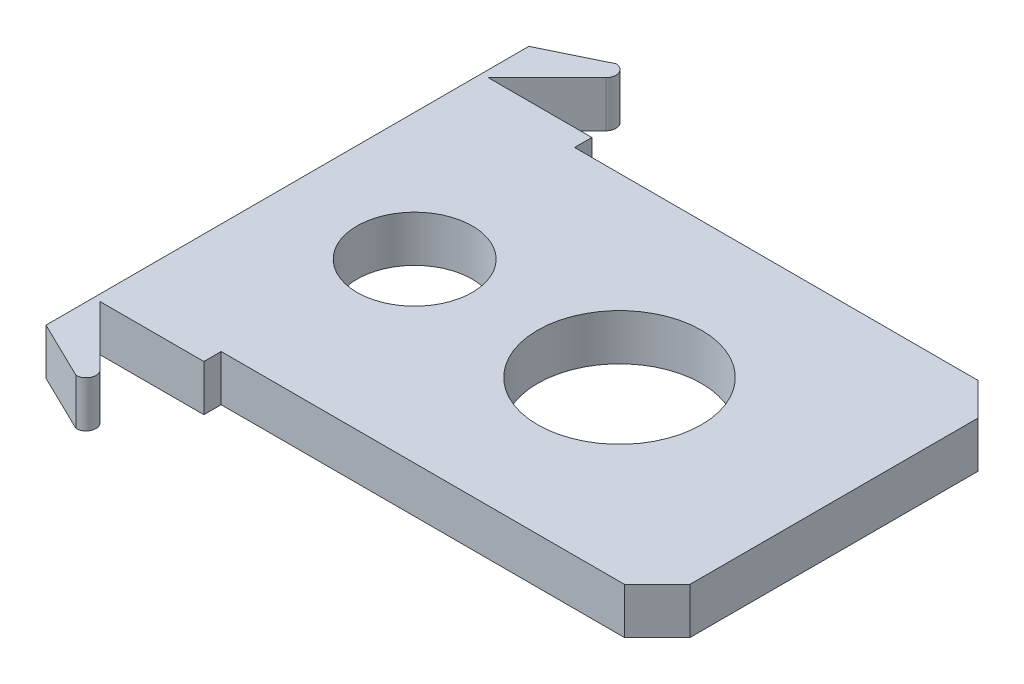
from build123d import *

# Parameters (mm, degrees)
SKETCH3_R           = 1
SKETCH3_R_2         = 1.421368712
BOSS_EXTRUDE1_DEPTH = 0.8


with BuildPart() as part:
    # Sketch3 → Boss-Extrude1 (new body)
    with BuildSketch(Plane(origin=(0, 0, 0), x_dir=(1, 0, 0), z_dir=(0, 1, 0))):
        with BuildLine():
            Line((40.65499317, -3.365685425), (42.45499317, -3.365685425))
            Line((42.45499317, -3.365685425), (42.45499317, -3.065685425))
            Line((42.45499317, -3.065685425), (49.45499317, -3.065685425))
            Line((49.45499317, -3.065685425), (50.020678594, -2.5))
            Line((50.020678594, -2.5), (50.020678594, 2.5))
            Line((50.020678594, 2.5), (49.45499317, 3.065685425))
            Line((49.45499317, 3.065685425), (42.45499317, 3.065685425))
            Line((42.45499317, 3.065685425), (42.45499317, 3.365685425))
            Line((42.45499317, 3.365685425), (40.65499317, 3.365685425))
            Line((40.65499317, 3.365685425), (41.67730974, 4.388001996))
            ThreePointArc((41.67730974, 4.388001996), (41.714807471, 4.576515818), (41.55499317, 4.68330032))
            Line((41.55499317, 4.68330032), (40.539309151, 4.188808518))
            Line((40.539309151, 4.188808518), (40.539309151, -4.188808518))
            Line((40.539309151, -4.188808518), (41.55499317, -4.68330032))
            ThreePointArc((41.55499317, -4.68330032), (41.714807471, -4.576515818), (41.67730974, -4.388001996))
            Line((41.67730974, -4.388001996), (40.65499317, -3.365685425))
        make_face()
        with Locations(Location((42.746488922, 0, 0), (0, 0, 270))):
            Circle(SKETCH3_R, mode=Mode.SUBTRACT)
        with Locations(Location((46.301021107, 0, 0), (0, 0, 270))):
            Circle(SKETCH3_R_2, mode=Mode.SUBTRACT)
    extrude(amount=BOSS_EXTRUDE1_DEPTH)


solid = part.part
